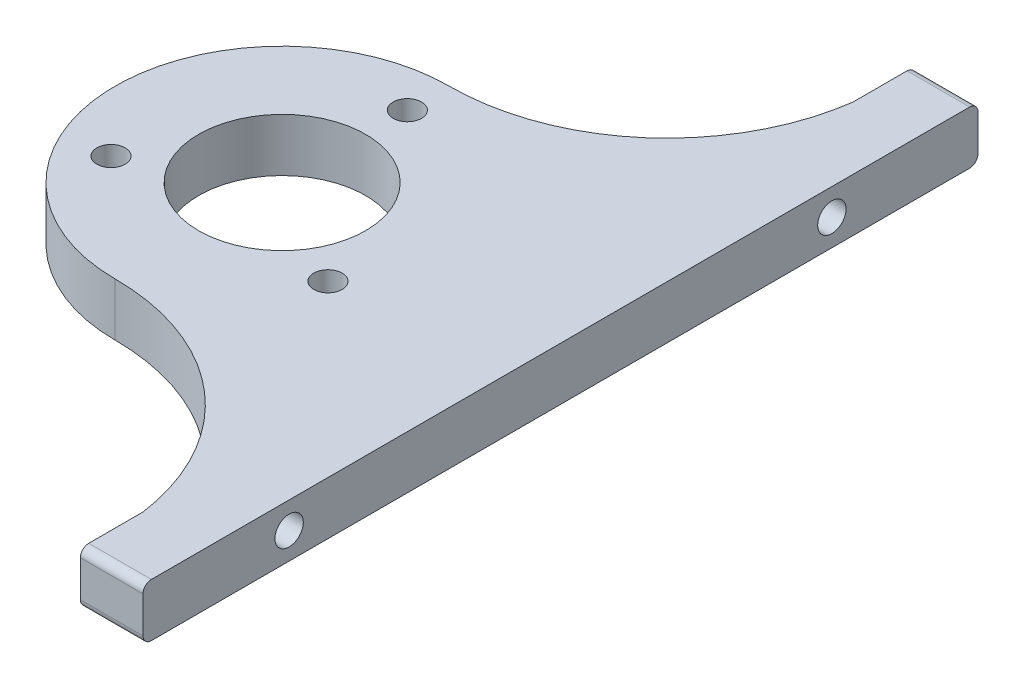
from build123d import *

# Parameters (mm, degrees)
SKETCH1_R                = 10
BOSS_EXTRUDE1_DEPTH      = 6.35
M3_CLEARANCE_HOLE1_D     = 3.4
M3_CLEARANCE_HOLE3_D     = 3.4
M3_CLEARANCE_HOLE3_DEPTH = 7
M3_CLEARANCE_HOLE3_TIP   = 1.021463052
FILLET1_R                = 1


with BuildPart() as part:
    # Sketch1 → Boss-Extrude1 (new body)
    with BuildSketch(Plane(origin=(0, 0, 0), x_dir=(1, 0, 0), z_dir=(0, 1, 0))):
        with BuildLine():
            Line((33.34, 50), (33.34, -50))
            Line((33.34, -50), (25.84, -50))
            Line((25.84, -50), (25.84, -42.5))
            ThreePointArc((25.84, -42.5), (17.131517738, -26.413305851), (0, -20))
            ThreePointArc((0, -20), (-20, 0), (0, 20))
            ThreePointArc((0, 20), (17.131517738, 26.413305851), (25.84, 42.5))
            Line((25.84, 42.5), (25.84, 50))
            Line((25.84, 50), (33.34, 50))
        make_face()
        with Locations(Location((0, 0, 0), (0, 0, 270))):
            Circle(SKETCH1_R, mode=Mode.SUBTRACT)
    extrude(amount=BOSS_EXTRUDE1_DEPTH)

    # M3 Clearance Hole1 (through all)
    with Locations(Plane(origin=(0, 6.35, 0), x_dir=(1, 0, 0), z_dir=(0, 1, 0))):
        with Locations((0, 15), (12.991881057, -7.499133975), (-12.988881057, -7.500866025), (0.001, 0)):
            Hole(M3_CLEARANCE_HOLE1_D / 2)

    # M3 Clearance Hole3
    with Locations(Plane(origin=(33.34, 0, 0), x_dir=(0, 0, -1), z_dir=(1, 0, 0))):
        with Locations((32.5, 3.175), (-32.5, 3.175)):
            Hole(M3_CLEARANCE_HOLE3_D / 2, depth=M3_CLEARANCE_HOLE3_DEPTH)
            with Locations((0, 0, -(M3_CLEARANCE_HOLE3_DEPTH + M3_CLEARANCE_HOLE3_TIP / 2))):  # 118° drill point
                Cone(0, M3_CLEARANCE_HOLE3_D / 2, M3_CLEARANCE_HOLE3_TIP, mode=Mode.SUBTRACT)

    # Fillet1
    fillet1_edges = [part.edges().sort_by_distance(p)[0] for p in [
        (29.59, 6.35, 50),
        (29.59, 6.35, -50),
        (29.59, 0, -50),
        (29.59, 0, 50),
    ]]
    fillet(fillet1_edges, radius=FILLET1_R)


solid = part.part
